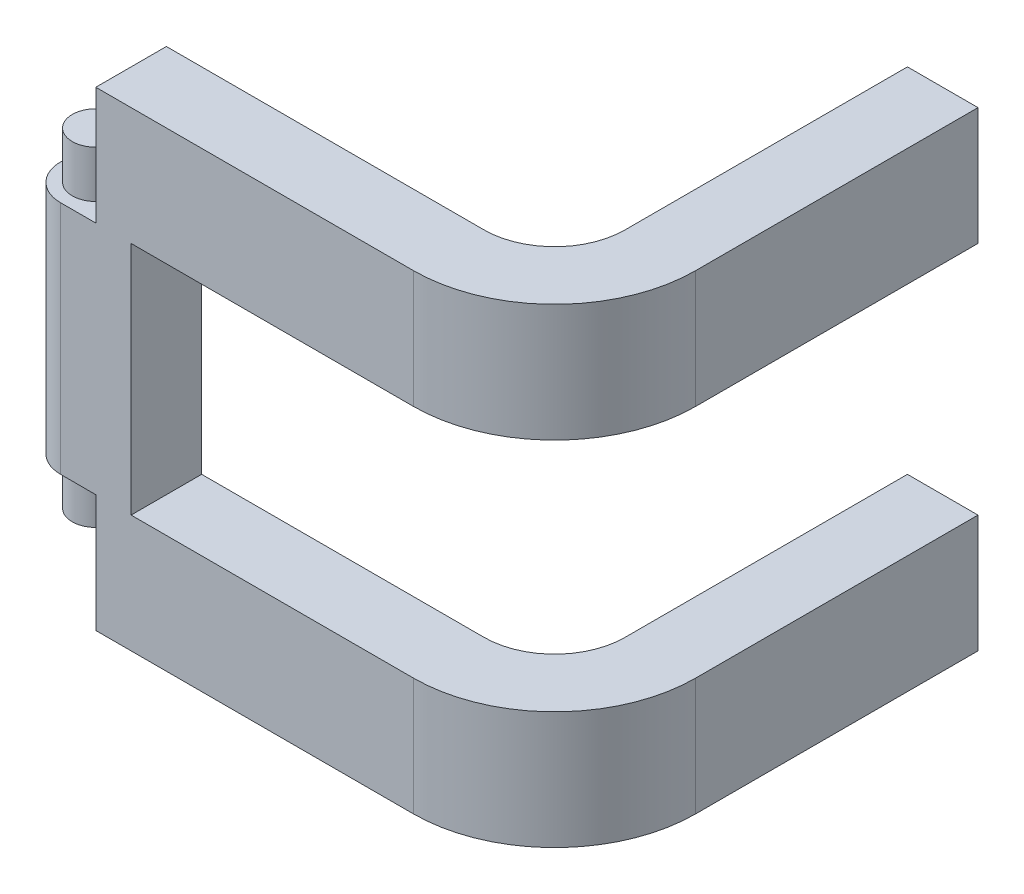
from build123d import *

# Parameters (mm, degrees)
EXTRUDE_1_DEPTH     = 50
CUT_EXTRUDE_START   = -50
SKETCH_2_W          = 99.785929991
SKETCH_2_H          = 100
CUT_EXTRUDE_1_DEPTH = 50
SKETCH_7_W          = 19.044434788
SKETCH_7_H          = 15
CUT_EXTRUDE_5_DEPTH = 15
SKETCH_9_R          = 5
CUT_EXTRUDE_6_DEPTH = 10


with BuildPart() as part:
    # 草图1 → 凸台-拉伸1 (new, symmetric)
    with BuildSketch(Plane(origin=(0, 0, 0), x_dir=(1, 0, 0), z_dir=(0, 1, 0))):
        with BuildLine():
            Line((0, 7.5), (75, 7.5))
            ThreePointArc((75, 7.5), (85.606601718, 11.893398282), (90, 22.5))
            Line((90, 22.5), (90, 82.5))
            Line((90, 82.5), (105, 82.5))
            Line((105, 82.5), (105, 22.5))
            ThreePointArc((105, 22.5), (96.213203436, 1.286796564), (75, -7.5))
            Line((75, -7.5), (0, -7.5))
            ThreePointArc((0, -7.5), (-7.5, 0), (0, 7.5))
        make_face()
    extrude(amount=EXTRUDE_1_DEPTH, both=True)

    # 草图2 → 切除-拉伸1 (cut)
    with BuildSketch(Plane(origin=(0, 25, 0), x_dir=(1, 0, 0), z_dir=(0, 1, 0)).offset(CUT_EXTRUDE_START)):
        with Locations((64.892964996, 39.075948396)):
            Rectangle(SKETCH_2_W, SKETCH_2_H)
    extrude(amount=CUT_EXTRUDE_1_DEPTH, mode=Mode.SUBTRACT)

    # 草图7 → 切除-拉伸5 (cut)
    with BuildSketch(Plane(origin=(0, 50, 0), x_dir=(1, 0, 0), z_dir=(0, 1, 0))):
        with Locations((-2.022217394, 0)):
            Rectangle(SKETCH_7_W, SKETCH_7_H)
    cut_extrude_5 = extrude(amount=-CUT_EXTRUDE_5_DEPTH, mode=Mode.SUBTRACT)

    # 镜向1: 切除-拉伸5 across plane
    add(cut_extrude_5.mirror(Plane.ZX), mode=Mode.SUBTRACT)

    # 草图9 → 切除-拉伸6 (cut)
    with BuildSketch(Plane(origin=(0, 35, 0), x_dir=(1, 0, 0), z_dir=(0, 1, 0))):
        with BuildLine():
            Line((0, 7.5), (7.5, 7.5))
            Line((7.5, 7.5), (7.5, -7.5))
            Line((7.5, -7.5), (0, -7.5))
            ThreePointArc((0, -7.5), (-7.5, 0), (0, 7.5))
        make_face()
        with Locations(Location((0, 0, 0), (0, 0, 270))):
            Circle(SKETCH_9_R, mode=Mode.SUBTRACT)
    cut_extrude_6 = extrude(amount=-CUT_EXTRUDE_6_DEPTH, mode=Mode.SUBTRACT)

    # 镜向2: 切除-拉伸6 across plane
    add(cut_extrude_6.mirror(Plane.ZX), mode=Mode.SUBTRACT)


solid = part.part
